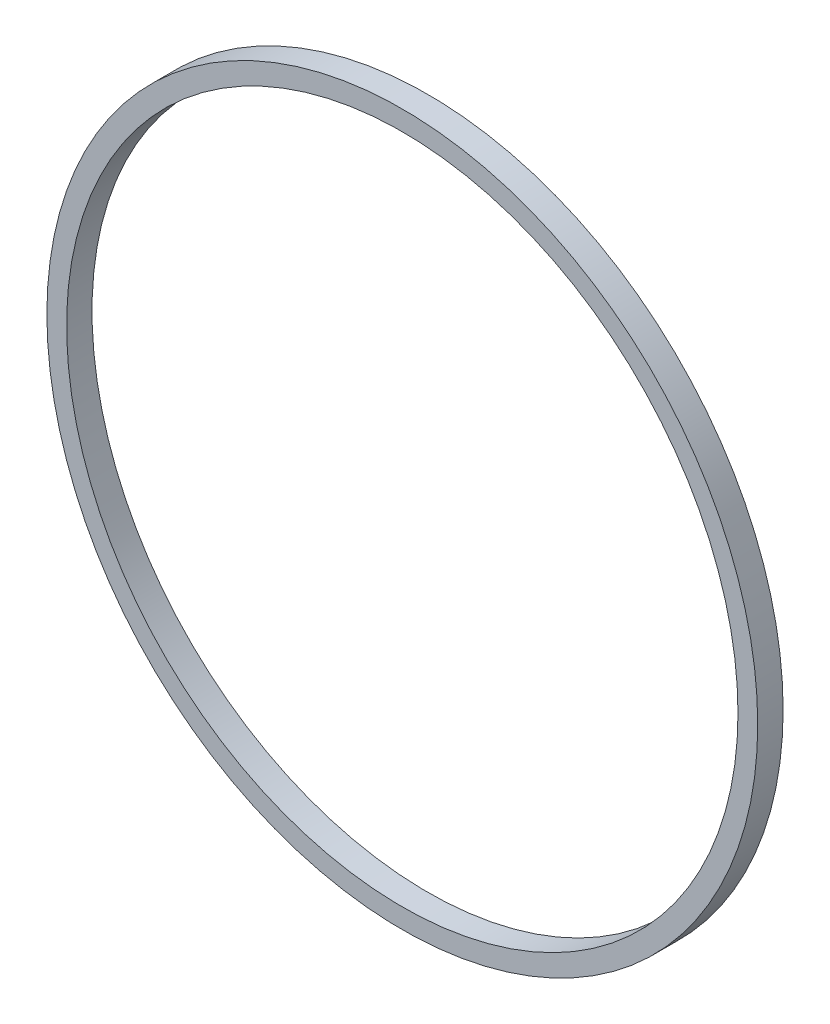
from build123d import *

# Parameters (mm, degrees)
SKETCH1_R           = 63
SKETCH1_R_2         = 59.5
BOSS_EXTRUDE1_DEPTH = 2.25


with BuildPart() as part:
    # Sketch1 → Boss-Extrude1 (new, symmetric)
    with BuildSketch(Plane.XY):
        with Locations((57.874950517, 92.254448376)):
            Circle(SKETCH1_R)
        with Locations((57.874950517, 92.254448376)):
            Circle(SKETCH1_R_2, mode=Mode.SUBTRACT)
    extrude(amount=BOSS_EXTRUDE1_DEPTH, both=True)


solid = part.part
